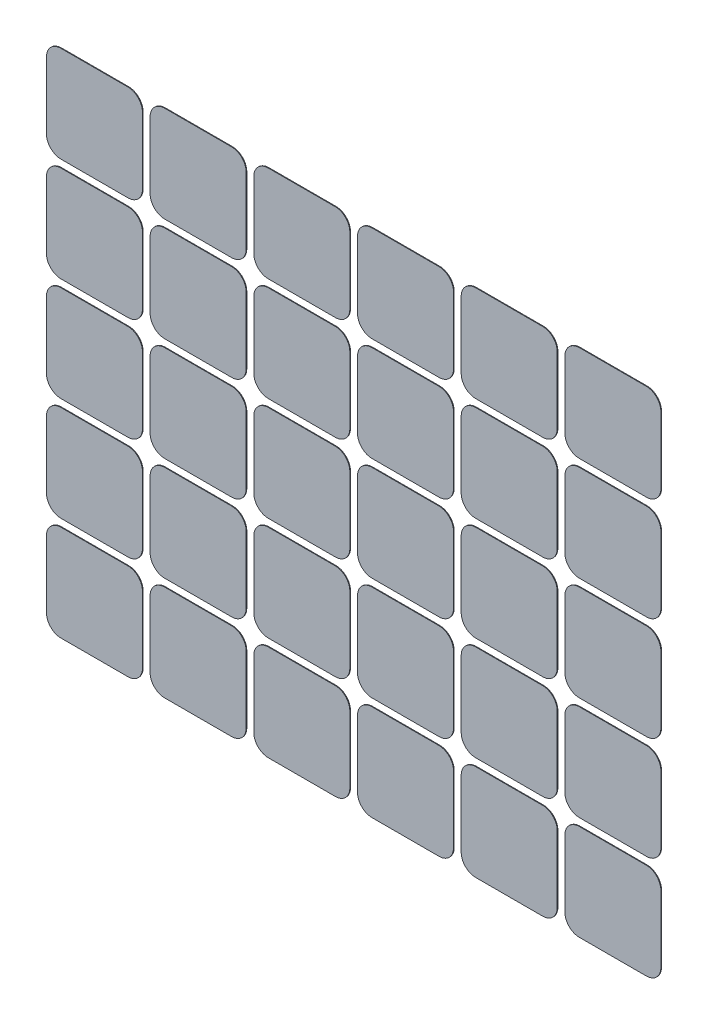
from build123d import *

# Parameters (mm, degrees)
AUFSATZ_LINEAR_AUSTRAGEN1_DEPTH = 0.2
LINEARES_MUSTER1_COUNT          = 6
LINEARES_MUSTER1_PITCH          = 31
LINEARES_MUSTER1_2_COUNT        = 5
LINEARES_MUSTER1_2_PITCH        = 31


with BuildPart() as part:
    # Skizze1 → Aufsatz-Linear austragen1 (new body)
    with BuildSketch(Plane.XY):
        with BuildLine():
            Line((10, 14.35), (-10, 14.35))
            ThreePointArc((-10, 14.35), (-13.075914498, 13.075914498), (-14.35, 10))
            Line((-14.35, 10), (-14.35, -10))
            ThreePointArc((-14.35, -10), (-13.075914498, -13.075914498), (-10, -14.35))
            Line((-10, -14.35), (10, -14.35))
            ThreePointArc((10, -14.35), (13.075914498, -13.075914498), (14.35, -10))
            Line((14.35, -10), (14.35, 10))
            ThreePointArc((14.35, 10), (13.075914498, 13.075914498), (10, 14.35))
        make_face()
    extrude(amount=AUFSATZ_LINEAR_AUSTRAGEN1_DEPTH)


with BuildPart() as lineares_muster1_1:
    # Lineares Muster1: pattern copy
    add(part.part.moved(Location(Vector(1, 0, 0) * (1 * LINEARES_MUSTER1_PITCH))))


with BuildPart() as lineares_muster1_2:
    # Lineares Muster1: pattern copy
    add(part.part.moved(Location(Vector(1, 0, 0) * (2 * LINEARES_MUSTER1_PITCH))))


with BuildPart() as lineares_muster1_3:
    # Lineares Muster1: pattern copy
    add(part.part.moved(Location(Vector(1, 0, 0) * (3 * LINEARES_MUSTER1_PITCH))))


with BuildPart() as lineares_muster1_4:
    # Lineares Muster1: pattern copy
    add(part.part.moved(Location(Vector(1, 0, 0) * (4 * LINEARES_MUSTER1_PITCH))))


with BuildPart() as lineares_muster1_5:
    # Lineares Muster1: pattern copy
    add(part.part.moved(Location(Vector(1, 0, 0) * (5 * LINEARES_MUSTER1_PITCH))))


with BuildPart() as lineares_muster1_2_1:
    # Lineares Muster1 2: pattern copy
    add(part.part.moved(Location(Vector(0, 1, 0) * (1 * LINEARES_MUSTER1_2_PITCH))))


with BuildPart() as lineares_muster1_2_2:
    # Lineares Muster1 2: pattern copy
    add(part.part.moved(Location(Vector(0, 1, 0) * (2 * LINEARES_MUSTER1_2_PITCH))))


with BuildPart() as lineares_muster1_2_3:
    # Lineares Muster1 2: pattern copy
    add(part.part.moved(Location(Vector(0, 1, 0) * (3 * LINEARES_MUSTER1_2_PITCH))))


with BuildPart() as lineares_muster1_2_4:
    # Lineares Muster1 2: pattern copy
    add(part.part.moved(Location(Vector(0, 1, 0) * (4 * LINEARES_MUSTER1_2_PITCH))))


with BuildPart() as lineares_muster1_2_5:
    # Lineares Muster1 2: pattern copy
    add(lineares_muster1_1.part.moved(Location(Vector(0, 1, 0) * (1 * LINEARES_MUSTER1_2_PITCH))))


with BuildPart() as lineares_muster1_2_6:
    # Lineares Muster1 2: pattern copy
    add(lineares_muster1_1.part.moved(Location(Vector(0, 1, 0) * (2 * LINEARES_MUSTER1_2_PITCH))))


with BuildPart() as lineares_muster1_2_7:
    # Lineares Muster1 2: pattern copy
    add(lineares_muster1_1.part.moved(Location(Vector(0, 1, 0) * (3 * LINEARES_MUSTER1_2_PITCH))))


with BuildPart() as lineares_muster1_2_8:
    # Lineares Muster1 2: pattern copy
    add(lineares_muster1_1.part.moved(Location(Vector(0, 1, 0) * (4 * LINEARES_MUSTER1_2_PITCH))))


with BuildPart() as lineares_muster1_2_9:
    # Lineares Muster1 2: pattern copy
    add(lineares_muster1_2.part.moved(Location(Vector(0, 1, 0) * (1 * LINEARES_MUSTER1_2_PITCH))))


with BuildPart() as lineares_muster1_2_10:
    # Lineares Muster1 2: pattern copy
    add(lineares_muster1_2.part.moved(Location(Vector(0, 1, 0) * (2 * LINEARES_MUSTER1_2_PITCH))))


with BuildPart() as lineares_muster1_2_11:
    # Lineares Muster1 2: pattern copy
    add(lineares_muster1_2.part.moved(Location(Vector(0, 1, 0) * (3 * LINEARES_MUSTER1_2_PITCH))))


with BuildPart() as lineares_muster1_2_12:
    # Lineares Muster1 2: pattern copy
    add(lineares_muster1_2.part.moved(Location(Vector(0, 1, 0) * (4 * LINEARES_MUSTER1_2_PITCH))))


with BuildPart() as lineares_muster1_2_13:
    # Lineares Muster1 2: pattern copy
    add(lineares_muster1_3.part.moved(Location(Vector(0, 1, 0) * (1 * LINEARES_MUSTER1_2_PITCH))))


with BuildPart() as lineares_muster1_2_14:
    # Lineares Muster1 2: pattern copy
    add(lineares_muster1_3.part.moved(Location(Vector(0, 1, 0) * (2 * LINEARES_MUSTER1_2_PITCH))))


with BuildPart() as lineares_muster1_2_15:
    # Lineares Muster1 2: pattern copy
    add(lineares_muster1_3.part.moved(Location(Vector(0, 1, 0) * (3 * LINEARES_MUSTER1_2_PITCH))))


with BuildPart() as lineares_muster1_2_16:
    # Lineares Muster1 2: pattern copy
    add(lineares_muster1_3.part.moved(Location(Vector(0, 1, 0) * (4 * LINEARES_MUSTER1_2_PITCH))))


with BuildPart() as lineares_muster1_2_17:
    # Lineares Muster1 2: pattern copy
    add(lineares_muster1_4.part.moved(Location(Vector(0, 1, 0) * (1 * LINEARES_MUSTER1_2_PITCH))))


with BuildPart() as lineares_muster1_2_18:
    # Lineares Muster1 2: pattern copy
    add(lineares_muster1_4.part.moved(Location(Vector(0, 1, 0) * (2 * LINEARES_MUSTER1_2_PITCH))))


with BuildPart() as lineares_muster1_2_19:
    # Lineares Muster1 2: pattern copy
    add(lineares_muster1_4.part.moved(Location(Vector(0, 1, 0) * (3 * LINEARES_MUSTER1_2_PITCH))))


with BuildPart() as lineares_muster1_2_20:
    # Lineares Muster1 2: pattern copy
    add(lineares_muster1_4.part.moved(Location(Vector(0, 1, 0) * (4 * LINEARES_MUSTER1_2_PITCH))))


with BuildPart() as lineares_muster1_2_21:
    # Lineares Muster1 2: pattern copy
    add(lineares_muster1_5.part.moved(Location(Vector(0, 1, 0) * (1 * LINEARES_MUSTER1_2_PITCH))))


with BuildPart() as lineares_muster1_2_22:
    # Lineares Muster1 2: pattern copy
    add(lineares_muster1_5.part.moved(Location(Vector(0, 1, 0) * (2 * LINEARES_MUSTER1_2_PITCH))))


with BuildPart() as lineares_muster1_2_23:
    # Lineares Muster1 2: pattern copy
    add(lineares_muster1_5.part.moved(Location(Vector(0, 1, 0) * (3 * LINEARES_MUSTER1_2_PITCH))))


with BuildPart() as lineares_muster1_2_24:
    # Lineares Muster1 2: pattern copy
    add(lineares_muster1_5.part.moved(Location(Vector(0, 1, 0) * (4 * LINEARES_MUSTER1_2_PITCH))))


solid = Compound([part.part, lineares_muster1_1.part, lineares_muster1_2.part, lineares_muster1_3.part, lineares_muster1_4.part, lineares_muster1_5.part, lineares_muster1_2_1.part, lineares_muster1_2_2.part, lineares_muster1_2_3.part, lineares_muster1_2_4.part, lineares_muster1_2_5.part, lineares_muster1_2_6.part, lineares_muster1_2_7.part, lineares_muster1_2_8.part, lineares_muster1_2_9.part, lineares_muster1_2_10.part, lineares_muster1_2_11.part, lineares_muster1_2_12.part, lineares_muster1_2_13.part, lineares_muster1_2_14.part, lineares_muster1_2_15.part, lineares_muster1_2_16.part, lineares_muster1_2_17.part, lineares_muster1_2_18.part, lineares_muster1_2_19.part, lineares_muster1_2_20.part, lineares_muster1_2_21.part, lineares_muster1_2_22.part, lineares_muster1_2_23.part, lineares_muster1_2_24.part])
